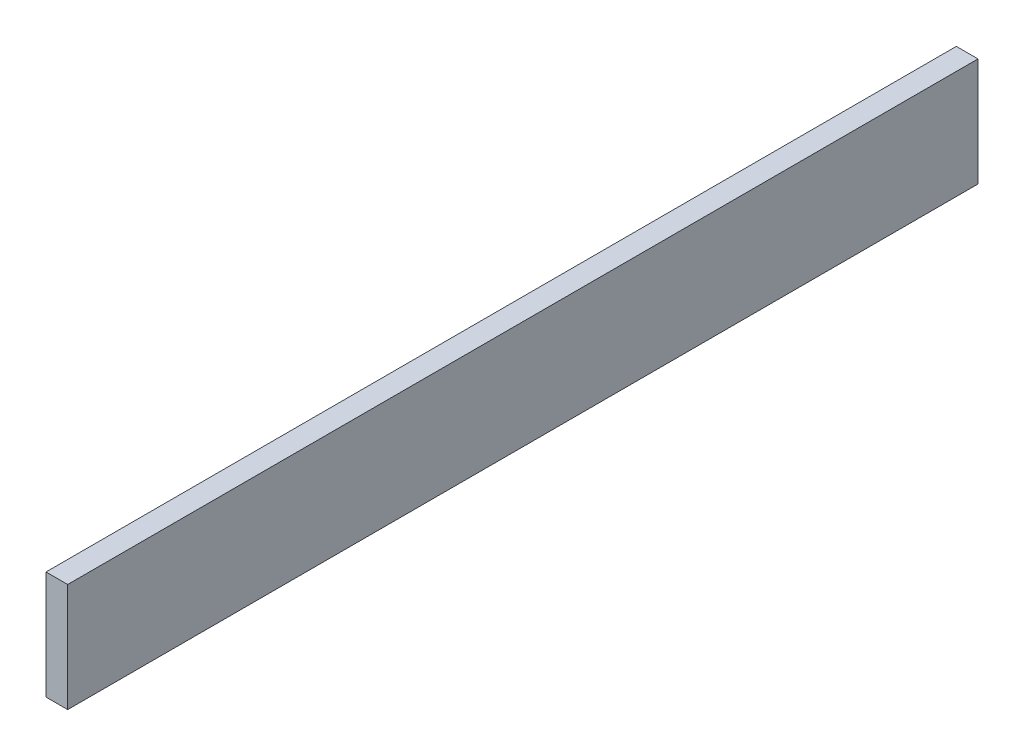
from build123d import *

# Parameters (mm, degrees)
SKETCH1_W           = 126
SKETCH1_H           = 15
BOSS_EXTRUDE1_DEPTH = 3


with BuildPart() as part:
    # Sketch1 → Boss-Extrude1 (new body)
    with BuildSketch(Plane(origin=(0, 0, 0), x_dir=(0, 0, -1), z_dir=(1, 0, 0))):
        Rectangle(SKETCH1_W, SKETCH1_H)
    extrude(amount=BOSS_EXTRUDE1_DEPTH)


solid = part.part
